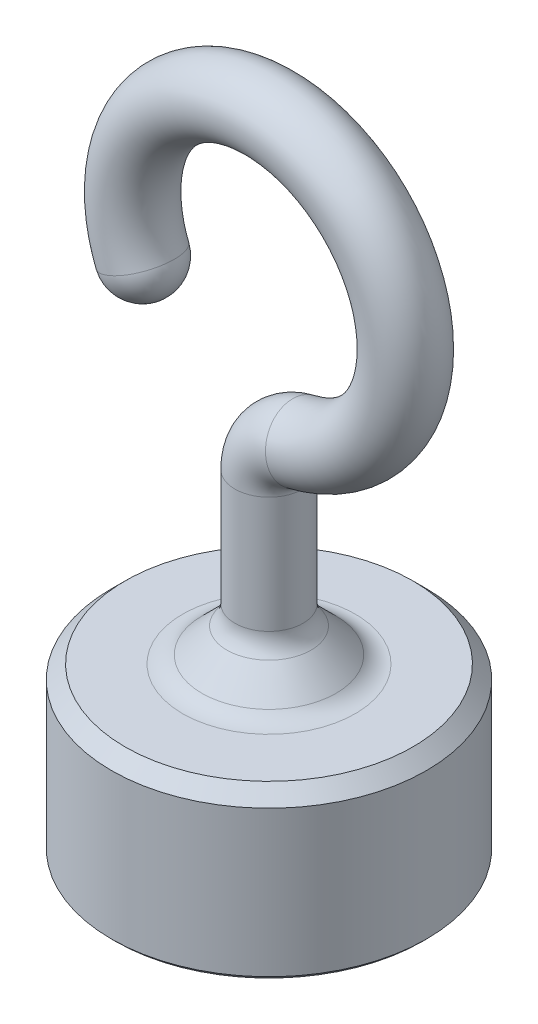
from build123d import *
from OCP.BRepFilletAPI import BRepFilletAPI_MakeChamfer

# Parameters (mm, degrees)
SKETCH1_R           = 14.6685
BOSS_EXTRUDE1_DEPTH = 15.24
SKETCH2_R           = 10.8585
CUT_EXTRUDE1_DEPTH  = 11.43
CUT_EXTRUDE1_DRAFT  = -3.5
SWEEP1_PROFILE_R    = 3.175
DOME1_FACE_RADIUS   = 3.175
DOME1_HEIGHT        = 3.175
CHAMFER1_SIZE       = 1.27
CHAMFER2_SIZE       = 0.381
CHAMFER2_SIZE2      = 0.406579433
CHAMFER3_SIZE       = 3.81
FILLET1_R           = 2.54


with BuildPart() as part:
    # Sketch1 → Boss-Extrude1 (new body)
    with BuildSketch(Plane(origin=(0, 0, 0), x_dir=(1, 0, 0), z_dir=(0, 1, 0))):
        with Locations(Location((0, 0, 0), (0, 0, 90))):
            Circle(SKETCH1_R)
    extrude(amount=BOSS_EXTRUDE1_DEPTH)


with BuildPart() as cut_extrude1_tool:
    # Sketch2 → Cut-Extrude1 (with draft: the straight prism first)
    with BuildSketch(Plane.XZ):
        Circle(SKETCH2_R)
    extrude(amount=-CUT_EXTRUDE1_DEPTH)
    # Cut-Extrude1: the draft: its side faces are tilted about the plane it starts from
    cut_extrude1_sides = [cut_extrude1_tool.faces().sort_by_distance(p)[0] for p in [
        (-10.8585, 5.715, 0),
    ]]
    draft(cut_extrude1_sides, Plane.XZ, CUT_EXTRUDE1_DRAFT)


with BuildPart() as part_1:
    add(part.part)

    # Cut-Extrude1: cut by cut_extrude1_tool
    add(cut_extrude1_tool.part, mode=Mode.SUBTRACT)

    # Sweep1: sweep along a path in Sketch3
    with BuildLine(Plane.XY) as sweep1_path:
        Line((0, 15.24), (0, 30.925629486))
        ThreePointArc((0, 30.925629486), (0.8211901, 33.28849118), (2.930769231, 34.632791913))
        ThreePointArc((2.930769231, 34.632791913), (5.843650644, 58.265714929), (-11.786275909, 42.259915412))
    # Sweep1 profile (on start of the path) → Sweep1 (sweep)
    with BuildSketch(Plane.ZX.offset(15.24)):
        Circle(SWEEP1_PROFILE_R)
    sweep(path=sweep1_path.line)

    # Dome1: a dome of height H over a round flat face of radius A is a cap of a sphere of radius (A * A + H * H) / (2 * H)
    dome1_r = (DOME1_FACE_RADIUS * DOME1_FACE_RADIUS + DOME1_HEIGHT * DOME1_HEIGHT) / (2 * DOME1_HEIGHT)
    dome1_base = Plane((-11.786275909, 42.259915412, 0), z_dir=(0.372447605321, -0.928053221152, 0))
    with Locations(dome1_base.offset(DOME1_HEIGHT - dome1_r)):
        dome1_ball = Sphere(dome1_r, mode=Mode.PRIVATE)
    add(split(dome1_ball, bisect_by=dome1_base, keep=Keep.TOP, mode=Mode.PRIVATE))

    # Chamfer1
    chamfer1_edges = [part_1.edges().sort_by_distance(p)[0] for p in [
        (0, 15.24, 14.6685),
    ]]
    chamfer(chamfer1_edges, length=CHAMFER1_SIZE)

    # Chamfer2: one chamfer whose edges measure the first distance from different faces: ONE call of the kernel's chamfer builder (chamfer() names one face for all edges)
    chamfer2_edges_1 = [part_1.edges().sort_by_distance(p)[0] for p in [
        (0, 0, 14.6685),
    ]]
    chamfer2_edges_2 = [part_1.edges().sort_by_distance(p)[0] for p in [
        (-10.8585, 0, 0),
    ]]
    chamfer2_side_2 = [part_1.faces().sort_by_distance(p)[0] for p in [
        (0, 0, 14.253612167),
    ]]
    chamfer2 = BRepFilletAPI_MakeChamfer(part_1.part.solid().wrapped)
    for e in chamfer2_edges_1:
        chamfer2.Add(CHAMFER2_SIZE, e.wrapped)
    for e in chamfer2_edges_2:
        chamfer2.Add(CHAMFER2_SIZE, CHAMFER2_SIZE2, e.wrapped, chamfer2_side_2[0].wrapped)  # the first distance lies on this face
    add(Compound.cast(chamfer2.Shape()), mode=Mode.REPLACE)

    # Chamfer3
    chamfer3_edges = [part_1.edges().sort_by_distance(p)[0] for p in [
        (0, 15.24, -3.175),
    ]]
    chamfer(chamfer3_edges, length=CHAMFER3_SIZE)

    # Fillet1
    fillet1_edges = [part_1.edges().sort_by_distance(p)[0] for p in [
        (0, 15.24, -6.985),
        (0, 19.05, -3.175),
    ]]
    fillet(fillet1_edges, radius=FILLET1_R)


solid = part_1.part
